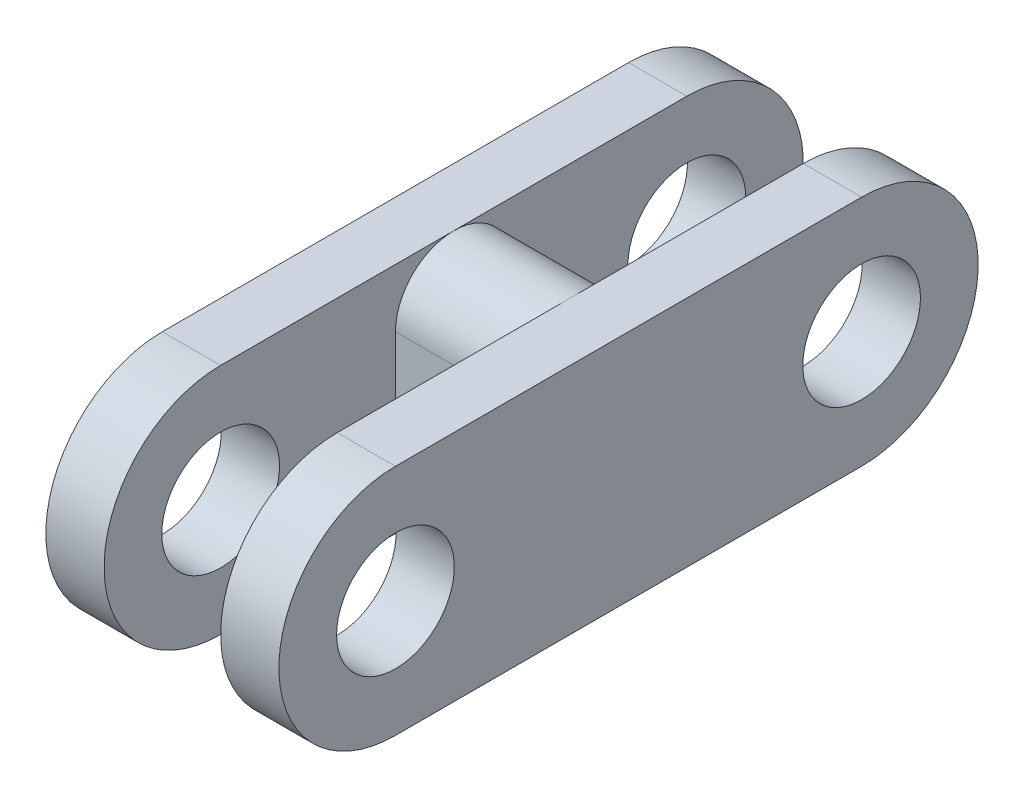
from build123d import *

# Parameters (mm, degrees)
BOSS_EXTRUDE1_DEPTH = 2.5
BOSS_EXTRUDE2_DEPTH = 5
BOSS_EXTRUDE3_DEPTH = 2.5
HOLE1_D             = 5.05
HOLE1_DEPTH         = 2.5
HOLE2_D             = 5.05
HOLE2_DEPTH         = 2.5
HOLE3_D             = 5.05
HOLE3_DEPTH         = 10


with BuildPart() as part:
    # Sketch1 → Boss-Extrude1 (new body)
    with BuildSketch(Plane(origin=(0, 0, 0), x_dir=(0, -1, 0), z_dir=(-1, 0, 0))):
        with BuildLine():
            Line((10, 5), (10, 25))
            ThreePointArc((10, 25), (5, 30), (0, 25))
            Line((0, 25), (0, 5))
            ThreePointArc((0, 5), (5, 0), (10, 5))
        make_face()
    extrude(amount=-BOSS_EXTRUDE1_DEPTH)

    # Sketch2 → Boss-Extrude2 (add)
    with BuildSketch(Plane(origin=(2.5, 0, 0), x_dir=(0, 0, -1), z_dir=(1, 0, 0))):
        with BuildLine():
            Line((-17.5, -7.5), (-17.5, -2.5))
            ThreePointArc((-17.5, -2.5), (-15, 0), (-12.5, -2.5))
            Line((-12.5, -2.5), (-12.5, -7.5))
            ThreePointArc((-12.5, -7.5), (-15, -10), (-17.5, -7.5))
        make_face()
    extrude(amount=BOSS_EXTRUDE2_DEPTH)

    # Sketch3 → Boss-Extrude3 (add)
    with BuildSketch(Plane(origin=(7.5, 0, 0), x_dir=(0, 0, -1), z_dir=(1, 0, 0))):
        with BuildLine():
            Line((-25, 0), (-5, 0))
            ThreePointArc((-5, 0), (0, -5), (-5, -10))
            Line((-5, -10), (-25, -10))
            ThreePointArc((-25, -10), (-30, -5), (-25, 0))
        make_face()
    extrude(amount=BOSS_EXTRUDE3_DEPTH)

    # Hole1
    with Locations(Plane(origin=(10, 0, 0), x_dir=(0, 0, -1), z_dir=(1, 0, 0))):
        with Locations((-5, -5)):
            Hole(HOLE1_D / 2, depth=HOLE1_DEPTH)

    # Hole2
    with Locations(Plane.ZY.offset(-7.5)):
        with Locations((25, -5)):
            Hole(HOLE2_D / 2, depth=HOLE2_DEPTH)

    # Hole3
    with Locations(Plane.ZY):
        with Locations((25, -5), (5, -5)):
            Hole(HOLE3_D / 2, depth=HOLE3_DEPTH)


solid = part.part
